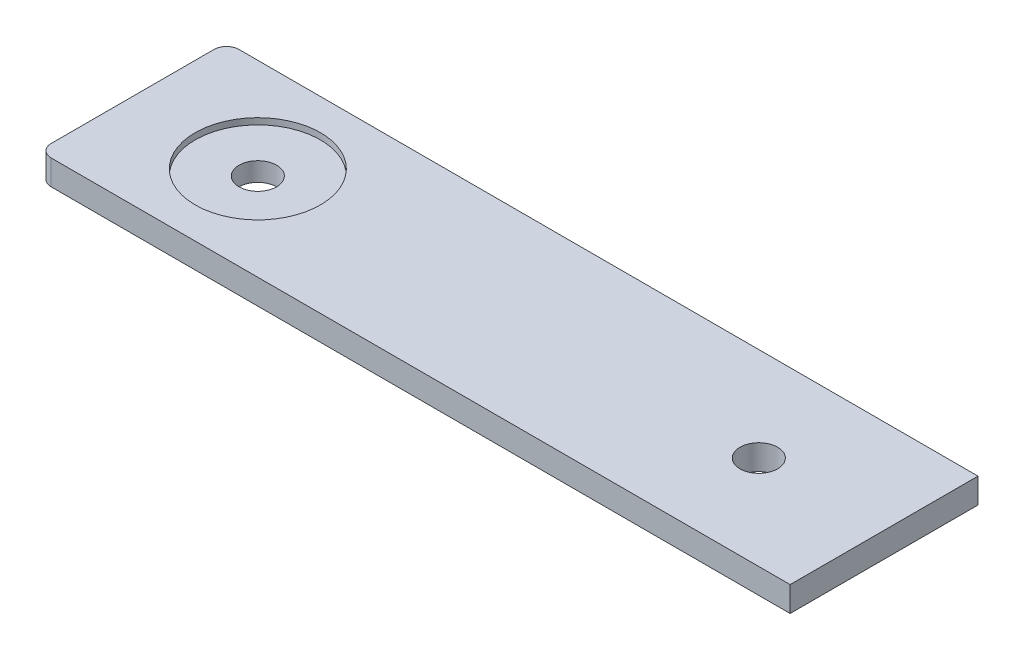
from build123d import *

# Parameters (mm, degrees)
BOSS_EXTRUDE1_DEPTH = 2
SKETCH2_R           = 5
CUT_EXTRUDE1_DEPTH  = 0.5
FILLET1_R           = 1


with BuildPart() as part:
    # Sketch1 → Boss-Extrude1 (new body)
    with BuildSketch(Plane(origin=(0, 0, 0), x_dir=(1, 0, 0), z_dir=(0, 1, 0))):
        with BuildLine():
            Line((60, 7.5), (51.5, 7.5))
            ThreePointArc((51.5, 7.5), (50, 6), (48.5, 7.5))
            Line((48.5, 7.5), (11.5, 7.5))
            ThreePointArc((11.5, 7.5), (10, 6), (8.5, 7.5))
            Line((8.5, 7.5), (0, 7.5))
            Line((0, 7.5), (0, 0))
            Line((0, 0), (60, 0))
            Line((60, 0), (60, 7.5))
        make_face()
        with BuildLine():
            ThreePointArc((48.5, 7.5), (50, 9), (51.5, 7.5))
            Line((51.5, 7.5), (60, 7.5))
            Line((60, 7.5), (60, 15))
            Line((60, 15), (0, 15))
            Line((0, 15), (0, 7.5))
            Line((0, 7.5), (8.5, 7.5))
            ThreePointArc((8.5, 7.5), (10, 9), (11.5, 7.5))
            Line((11.5, 7.5), (48.5, 7.5))
        make_face()
    extrude(amount=BOSS_EXTRUDE1_DEPTH)

    # Sketch2 → Cut-Extrude1 (cut)
    with BuildSketch(Plane(origin=(0, 2, 0), x_dir=(1, 0, 0), z_dir=(0, 1, 0))):
        with Locations(Location((10, 7.5, 0), (0, 0, 270))):
            Circle(SKETCH2_R)
    extrude(amount=-CUT_EXTRUDE1_DEPTH, mode=Mode.SUBTRACT)

    # Fillet1
    fillet1_edges = [part.edges().sort_by_distance(p)[0] for p in [
        (0, 1, 0),
        (0, 1, -15),
    ]]
    fillet(fillet1_edges, radius=FILLET1_R)


solid = part.part
